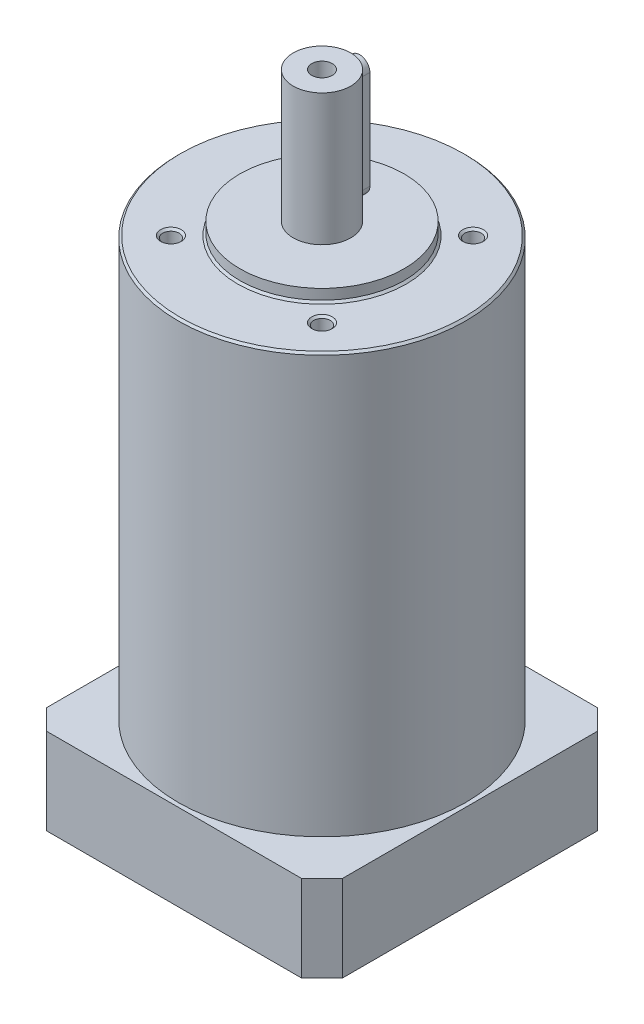
from build123d import *

# Parameters (mm, degrees)
SKETCH_1_R             = 35
EXTRUDE_1_DEPTH        = 102
SKETCH_2_R             = 20
EXTRUDE_2_DEPTH        = 3
SKETCH_3_R             = 7
EXTRUDE_3_DEPTH        = 32
SKETCH_4_W             = 72
SKETCH_4_H             = 72
EXTRUDE_4_DEPTH        = 21
CHAMFER_1_SIZE         = 5
SKETCH_5_R             = 2
CUT_EXTRUDE_1_DEPTH    = 10
CHAMFER_2_SIZE         = 0.5
SKETCH_6_R             = 25
CUT_EXTRUDE_2_DEPTH    = 9
SKETCH_7_R             = 8
CUT_EXTRUDE_3_DEPTH    = 9
SKETCH_9_R             = 2.5
CUT_EXTRUDE_4_DEPTH    = 9
SKETCH_10_R            = 2.5
CUT_EXTRUDE_5_DEPTH    = 19
EXTRUDE_1_2_DEPTH      = 1
EXTRUDE_1_2_DEPTH_BACK = 2
SKETCH_13_R            = 7.497429265
SKETCH_13_R_2          = 6
EXTRUDE_2_2_DEPTH      = 9
CUT_EXTRUDE_START      = -19
SKETCH_14_R            = 6
CUT_EXTRUDE_6_DEPTH    = 19


with BuildPart() as part:
    # Эскиз1 → Extrude 1 (new body)
    with BuildSketch(Plane(origin=(0, 0, 0), x_dir=(1, 0, 0), z_dir=(0, 1, 0))):
        with Locations(Location((0, 0, 0), (0, 0, 270))):
            Circle(SKETCH_1_R)
    extrude(amount=EXTRUDE_1_DEPTH)

    # Эскиз2 → Extrude 2 (add)
    with BuildSketch(Plane(origin=(0, 102, 0), x_dir=(1, 0, 0), z_dir=(0, 1, 0))):
        with Locations(Location((0, 0, 0), (0, 0, 270))):
            Circle(SKETCH_2_R)
    extrude(amount=EXTRUDE_2_DEPTH)

    # Эскиз3 → Вытянуть3 (add)
    with BuildSketch(Plane(origin=(0, 105, 0), x_dir=(1, 0, 0), z_dir=(0, 1, 0))):
        with Locations(Location((0, 0, 0), (0, 0, 270))):
            Circle(SKETCH_3_R)
    extrude(amount=EXTRUDE_3_DEPTH)

    # Эскиз4 → Вытянуть4 (add)
    with BuildSketch(Plane.XZ):
        Rectangle(SKETCH_4_W, SKETCH_4_H)
    extrude(amount=EXTRUDE_4_DEPTH)

    # Фаска1
    chamfer_1_edges = [part.edges().sort_by_distance(p)[0] for p in [
        (-36, -10.5, 36),
        (-36, -10.5, -36),
        (36, -10.5, -36),
        (36, -10.5, 36),
    ]]
    chamfer(chamfer_1_edges, length=CHAMFER_1_SIZE)

    # Эскиз5 → Вырез-Вытянуть1 (cut)
    with BuildSketch(Plane(origin=(0, 102, 0), x_dir=(1, 0, 0), z_dir=(0, 1, 0))):
        with Locations(Location((-18.384776311, 18.384776311, 0), (0, 0, 270))):
            Circle(SKETCH_5_R)
        with Locations(Location((18.384776311, 18.384776311, 0), (0, 0, 270))):
            Circle(SKETCH_5_R)
        with Locations(Location((-18.384776311, -18.384776311, 0), (0, 0, 270))):
            Circle(SKETCH_5_R)
        with Locations(Location((18.384776311, -18.384776311, 0), (0, 0, 270))):
            Circle(SKETCH_5_R)
    extrude(amount=-CUT_EXTRUDE_1_DEPTH, mode=Mode.SUBTRACT)

    # Фаска2
    chamfer_2_edges = [part.edges().sort_by_distance(p)[0] for p in [
        (0, 102, -35),
        (-18.384776311, 102, -20.384776311),
        (18.384776311, 102, -20.384776311),
        (-18.384776311, 102, 16.384776311),
        (0, 102, -20),
        (18.384776311, 102, 16.384776311),
    ]]
    chamfer(chamfer_2_edges, length=CHAMFER_2_SIZE)

    # Эскиз6 → Вырез-Вытянуть2 (cut)
    with BuildSketch(Plane.XZ.offset(21)):
        with Locations(Location((0, 0, 0), (0, 0, 270))):
            Circle(SKETCH_6_R)
    extrude(amount=-CUT_EXTRUDE_2_DEPTH, mode=Mode.SUBTRACT)

    # Эскиз7 → Вырез-Вытянуть3 (cut)
    with BuildSketch(Plane.XZ.offset(12)):
        with Locations(Location((0, 0, 0), (0, 0, 270))):
            Circle(SKETCH_7_R)
    extrude(amount=-CUT_EXTRUDE_3_DEPTH, mode=Mode.SUBTRACT)

    # Эскиз9 → Вырез-Вытянуть4 (cut)
    with BuildSketch(Plane.XZ.offset(21)):
        with Locations(Location((-24.748737342, 24.748737342, 0), (0, 0, 270))):
            Circle(SKETCH_9_R)
        with Locations(Location((24.748737342, 24.748737342, 0), (0, 0, 270))):
            Circle(SKETCH_9_R)
        with Locations(Location((-24.748737342, -24.748737342, 0), (0, 0, 270))):
            Circle(SKETCH_9_R)
        with Locations(Location((24.748737342, -24.748737342, 0), (0, 0, 270))):
            Circle(SKETCH_9_R)
    extrude(amount=-CUT_EXTRUDE_4_DEPTH, mode=Mode.SUBTRACT)

    # Эскиз10 → Вырез-Вытянуть5 (cut)
    with BuildSketch(Plane(origin=(0, 137, 0), x_dir=(1, 0, 0), z_dir=(0, 1, 0))):
        with Locations(Location((0, 0, 0), (0, 0, 270))):
            Circle(SKETCH_10_R)
    extrude(amount=-CUT_EXTRUDE_5_DEPTH, mode=Mode.SUBTRACT)

    # Эскиз12 → Extrude 1 2 (add, two sides: drawn at the far end of the back side and taken through both)
    with BuildSketch(Plane.XY.offset(-7.151021082).offset(-EXTRUDE_1_2_DEPTH_BACK)):
        with BuildLine():
            Line((2.5, 133.056281521), (2.5, 109.056281521))
            ThreePointArc((2.5, 109.056281521), (0, 106.556281521), (-2.5, 109.056281521))
            Line((-2.5, 109.056281521), (-2.5, 133.056281521))
            ThreePointArc((-2.5, 133.056281521), (0, 135.556281521), (2.5, 133.056281521))
        make_face()
    extrude(amount=EXTRUDE_1_2_DEPTH + EXTRUDE_1_2_DEPTH_BACK)

    # Эскиз13 → Extrude 2 2 (add)
    with BuildSketch(Plane.XZ.offset(3)):
        with Locations(Location((0, 0, 0), (0, 0, 90))):
            Circle(SKETCH_13_R)
        with Locations(Location((0, 0, 0), (0, 0, 90))):
            Circle(SKETCH_13_R_2, mode=Mode.SUBTRACT)
    extrude(amount=EXTRUDE_2_2_DEPTH)

    # Эскиз14 → Вырез-Вытянуть6 (cut)
    with BuildSketch(Plane.XZ.offset(3).offset(CUT_EXTRUDE_START)):
        with Locations(Location((0, 0, 0), (0, 0, 90))):
            Circle(SKETCH_14_R)
    extrude(amount=CUT_EXTRUDE_6_DEPTH, mode=Mode.SUBTRACT)


solid = part.part
